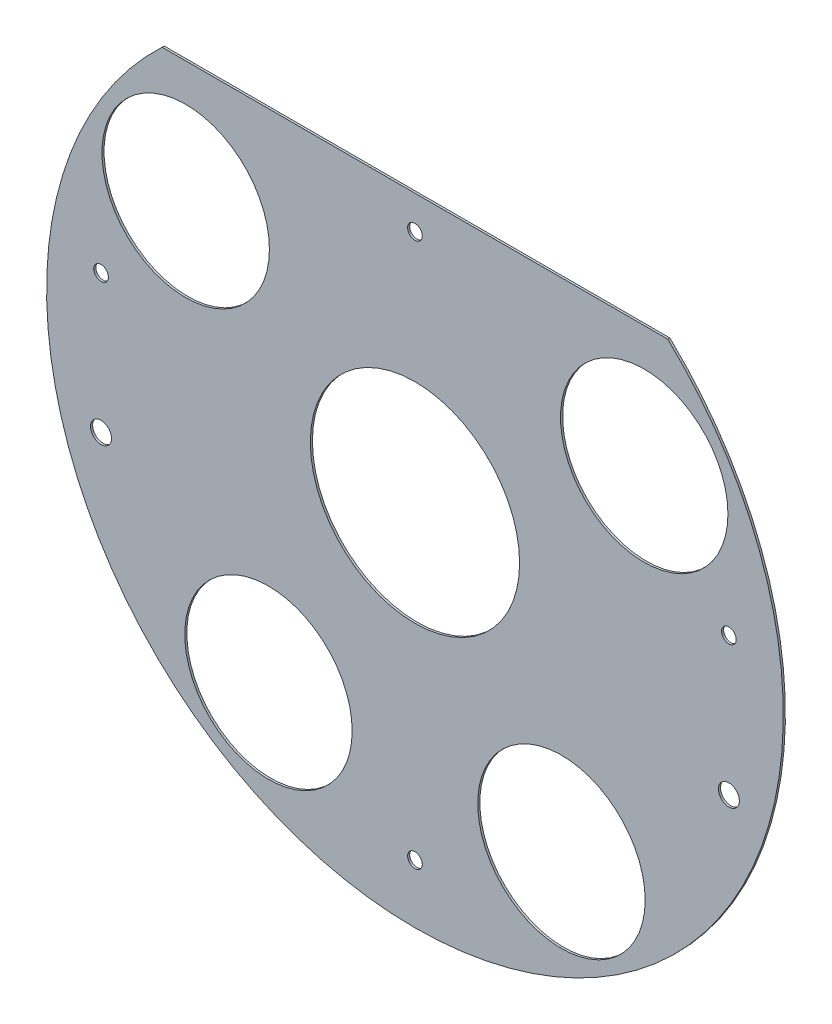
from build123d import *

# Parameters (mm, degrees)
SKETCH1_R      = 25
SKETCH1_R_2    = 20
SKETCH1_R_3    = 1.75
SKETCH1_R_4    = 2.5
EXTRUDE1_DEPTH = 0.5


with BuildPart() as part:
    # Sketch1 → Extrude1 (new body)
    with BuildSketch(Plane.XY):
        with BuildLine():
            Line((-60.398675482, 64), (60.398675482, 64))
            ThreePointArc((60.398675482, 64), (0, -88), (-60.398675482, 64))
        make_face()
        Circle(SKETCH1_R, mode=Mode.SUBTRACT)
        with Locations((-35, -54.772255751)):
            Circle(SKETCH1_R_2, mode=Mode.SUBTRACT)
        with Locations((-54.772255751, 35)):
            Circle(SKETCH1_R_2, mode=Mode.SUBTRACT)
        with Locations((54.772255751, 35)):
            Circle(SKETCH1_R_2, mode=Mode.SUBTRACT)
        with Locations((35, -54.772255751)):
            Circle(SKETCH1_R_2, mode=Mode.SUBTRACT)
        with Locations((-75, 10)):
            Circle(SKETCH1_R_3, mode=Mode.SUBTRACT)
        with Locations((0, 56)):
            Circle(SKETCH1_R_3, mode=Mode.SUBTRACT)
        with Locations((0, -74)):
            Circle(SKETCH1_R_3, mode=Mode.SUBTRACT)
        with Locations((75, 10)):
            Circle(SKETCH1_R_3, mode=Mode.SUBTRACT)
        with Locations((-75, -23)):
            Circle(SKETCH1_R_4, mode=Mode.SUBTRACT)
        with Locations((75, -23)):
            Circle(SKETCH1_R_4, mode=Mode.SUBTRACT)
    extrude(amount=EXTRUDE1_DEPTH)


solid = part.part
